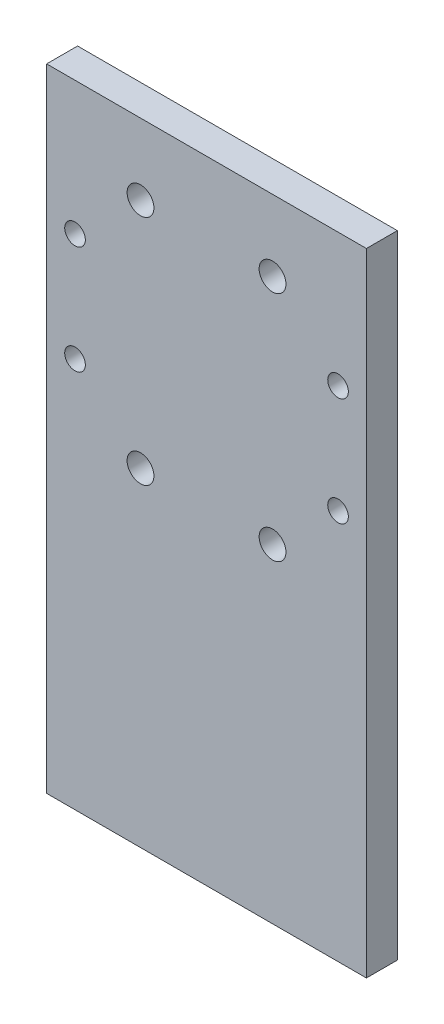
from build123d import *

# Parameters (mm, degrees)
SKETCH_1_W      = 62
SKETCH_1_H      = 122.5
SKETCH_1_R      = 2
SKETCH_1_R_2    = 2.6
EXTRUDE_1_DEPTH = 6


with BuildPart() as part:
    # 草图1 → 凸台-拉伸1 (new body)
    with BuildSketch(Plane.XY):
        Rectangle(SKETCH_1_W, SKETCH_1_H)
        with Locations((-25.5, 35.45)):
            Circle(SKETCH_1_R, mode=Mode.SUBTRACT)
        with Locations((-25.5, 14.45)):
            Circle(SKETCH_1_R, mode=Mode.SUBTRACT)
        with Locations(Location((25.5, 14.45, 0), (0, 0, 180))):
            Circle(SKETCH_1_R, mode=Mode.SUBTRACT)
        with Locations(Location((25.5, 35.45, 0), (0, 0, 180))):
            Circle(SKETCH_1_R, mode=Mode.SUBTRACT)
        with Locations((-12.8, 47.45)):
            Circle(SKETCH_1_R_2, mode=Mode.SUBTRACT)
        with Locations(Location((12.8, 47.45, 0), (0, 0, 180))):
            Circle(SKETCH_1_R_2, mode=Mode.SUBTRACT)
        with Locations((12.8, 2.45)):
            Circle(SKETCH_1_R_2, mode=Mode.SUBTRACT)
        with Locations(Location((-12.8, 2.45, 0), (0, 0, 180))):
            Circle(SKETCH_1_R_2, mode=Mode.SUBTRACT)
    extrude(amount=EXTRUDE_1_DEPTH)


solid = part.part
